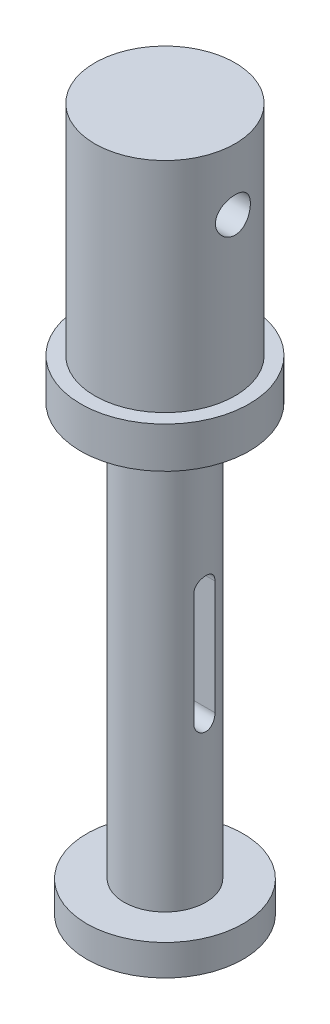
from build123d import *

# Parameters (mm, degrees)
CUT_EXTRUDE1_DEPTH      = 126.267501457
CUT_EXTRUDE1_DEPTH_BACK = 126.267501457
SKETCH2_R               = 2.986936388
CUT_EXTRUDE2_DEPTH      = 126.267501556
CUT_EXTRUDE2_DEPTH_BACK = 126.267501556


with BuildPart() as part:
    # Sketch1 → Revolve1 (revolve)
    with BuildSketch(Plane(origin=(0, 0, 0), x_dir=(0, 0, -1), z_dir=(1, 0, 0)), mode=Mode.PRIVATE) as revolve1_sk:
        Polygon((0, 123.60144971), (12, 123.60144971), (12, 86.261621461), (14.398412253, 86.261621461), (14.398412253, 79.261621461), (6.991481123, 79.261621461), (6.991481123, 8.748152398), (13.363236745, 8.748152398), (13.363236745, 3.47746721), (0, 3.47746721), align=None)
    revolve(revolve1_sk.sketch.rotate(Axis((0, 123.60144971, 0), (0, -1, 0)), 180), axis=Axis((0, 123.60144971, 0), (0, -1, 0)))

    # Sketch2 → Cut-Extrude1 (cut, two sides: drawn at the far end of the back side and taken through both)
    with BuildSketch(Plane(origin=(0, 0, 0), x_dir=(0, 0, -1), z_dir=(1, 0, 0)).offset(-CUT_EXTRUDE1_DEPTH_BACK)):
        with Locations((0, 113.066011559)):
            Circle(SKETCH2_R)
    extrude(amount=CUT_EXTRUDE1_DEPTH + CUT_EXTRUDE1_DEPTH_BACK, mode=Mode.SUBTRACT)

    # Sketch3 → Cut-Extrude2 (cut, two sides: drawn at the far end of the back side and taken through both)
    with BuildSketch(Plane(origin=(0, 0, 0), x_dir=(0, 0, -1), z_dir=(1, 0, 0)).offset(-CUT_EXTRUDE2_DEPTH_BACK)):
        with BuildLine():
            Line((1.8, 55.325549997), (1.8, 35.81578841))
            ThreePointArc((1.8, 35.81578841), (0, 34.01578841), (-1.8, 35.81578841))
            Line((-1.8, 35.81578841), (-1.8, 55.325549997))
            ThreePointArc((-1.8, 55.325549997), (0, 57.125549997), (1.8, 55.325549997))
        make_face()
    extrude(amount=CUT_EXTRUDE2_DEPTH + CUT_EXTRUDE2_DEPTH_BACK, mode=Mode.SUBTRACT)


solid = part.part
